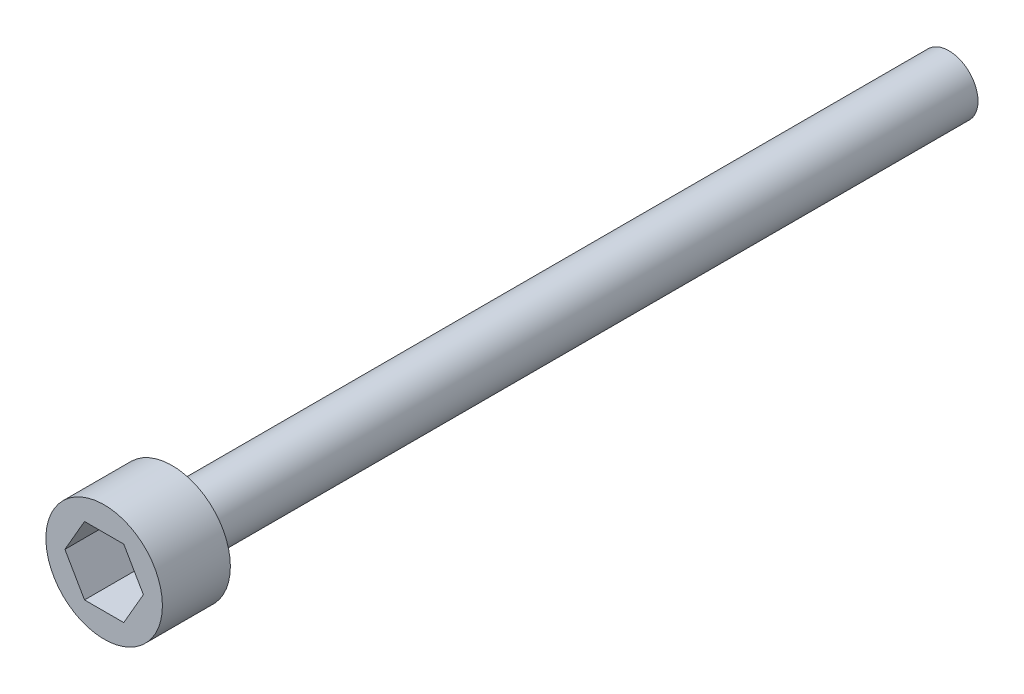
from build123d import *

# Parameters (mm, degrees)
SKETCH1_R                   = 3
HEAD_BOSS_EXTRUDE1_DEPTH    = 3.5
HEAD_HEX_CUT_EXTRUDE1_DEPTH = 2.8
SKETCH2_R                   = 1.5
SCREW_BOSS_EXTRUDE2_DEPTH   = 40


with BuildPart() as part:
    # Sketch1 → Head Boss-Extrude1 (new body)
    with BuildSketch(Plane.XY):
        Circle(SKETCH1_R)
    extrude(amount=HEAD_BOSS_EXTRUDE1_DEPTH)

    # Sketch3 → Head Hex Cut-Extrude1 (cut)
    with BuildSketch(Plane.XY.offset(3.5)):
        Polygon((-1.010362971, 1.75), (1.010362971, 1.75), (2.020725942, 0), (1.010362971, -1.75), (-1.010362971, -1.75), (-2.020725942, 0), align=None)
    extrude(amount=-HEAD_HEX_CUT_EXTRUDE1_DEPTH, mode=Mode.SUBTRACT)

    # Sketch2 → Screw Boss-Extrude2 (add)
    with BuildSketch(Plane.XY):
        Circle(SKETCH2_R)
    extrude(amount=-SCREW_BOSS_EXTRUDE2_DEPTH)


solid = part.part
